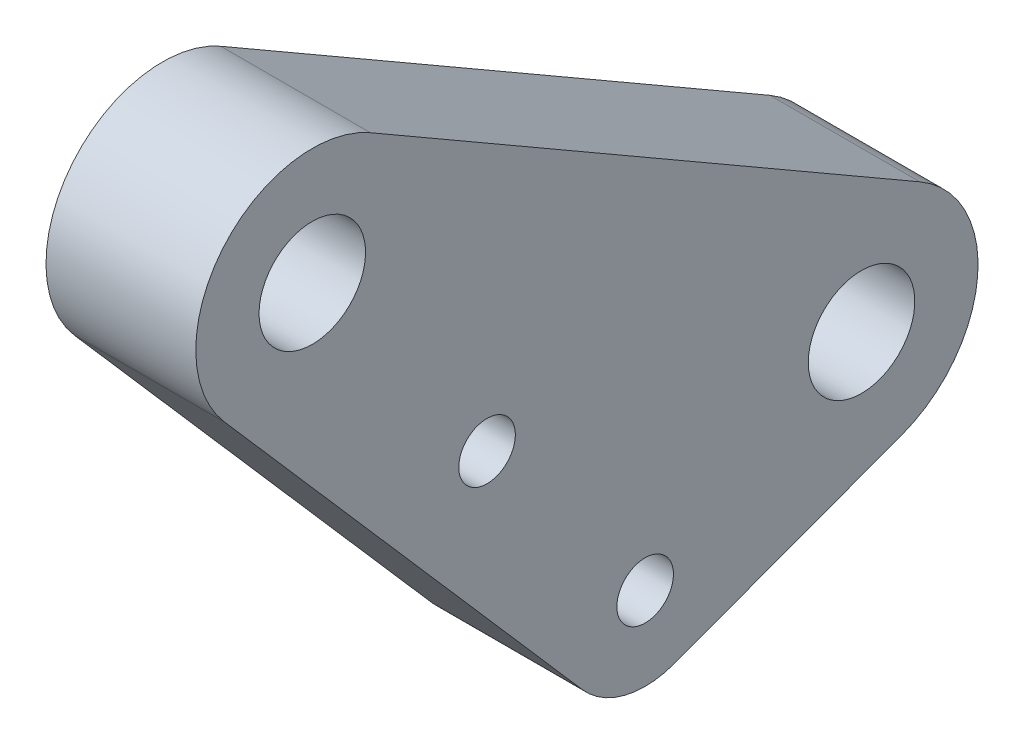
from build123d import *

# Parameters (mm, degrees)
SKETCH1_R           = 1.7
SKETCH1_R_2         = 3.2
BOSS_EXTRUDE1_DEPTH = 9


with BuildPart() as part:
    # Sketch1 → Boss-Extrude1 (new body)
    with BuildSketch(Plane(origin=(9, 0, 0), x_dir=(0, 0, -1), z_dir=(1, 0, 0))):
        with BuildLine():
            Line((3.5, 220.062177826), (-29.5, 239.11473671))
            ThreePointArc((-29.5, 239.11473671), (-38.403863659, 237.502082178), (-38.277822321, 228.454234021))
            Line((-38.277822321, 228.454234021), (-16.769873087, 203.768041124))
            ThreePointArc((-16.769873087, 203.768041124), (-14.23555473, 202.207622918), (-11.263470707, 202.363799344))
            Line((-11.263470707, 202.363799344), (2.43114101, 207.435736645))
            ThreePointArc((2.43114101, 207.435736645), (6.975052878, 213.40954479), (3.5, 220.062177826))
        make_face()
        with Locations(Location((-13, 207.052558883, 0), (0, 0, 180))):
            Circle(SKETCH1_R, mode=Mode.SUBTRACT)
        with Locations(Location((0, 214, 0), (0, 0, 180))):
            Circle(SKETCH1_R_2, mode=Mode.SUBTRACT)
        with Locations(Location((-33, 233.052558883, 0), (0, 0, 180))):
            Circle(SKETCH1_R_2, mode=Mode.SUBTRACT)
        with Locations(Location((-22.5, 219.052558883, 0), (0, 0, 180))):
            Circle(SKETCH1_R, mode=Mode.SUBTRACT)
    extrude(amount=-BOSS_EXTRUDE1_DEPTH)


solid = part.part
